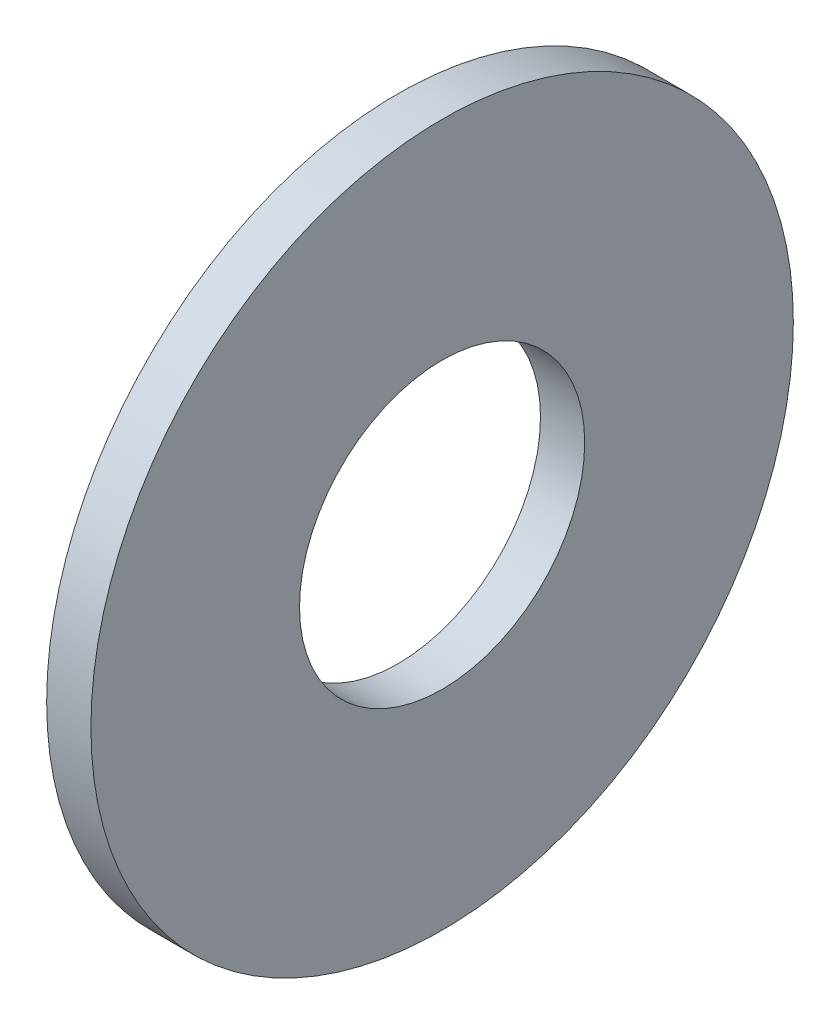
from build123d import *

# Parameters (mm, degrees)
SKETCH1_W = 1.6002
SKETCH1_H = 7.5438


with BuildPart() as part:
    # Sketch1 → Base-Revolve (revolve)
    with BuildSketch(Plane.XY, mode=Mode.PRIVATE) as base_revolve_sk:
        with Locations((-0.8001, 8.9281)):
            Rectangle(SKETCH1_W, SKETCH1_H)
    revolve(base_revolve_sk.sketch.rotate(Axis((-34.925, 0, 0), (1, 0, 0)), 90), axis=Axis((-34.925, 0, 0), (1, 0, 0)))


solid = part.part
